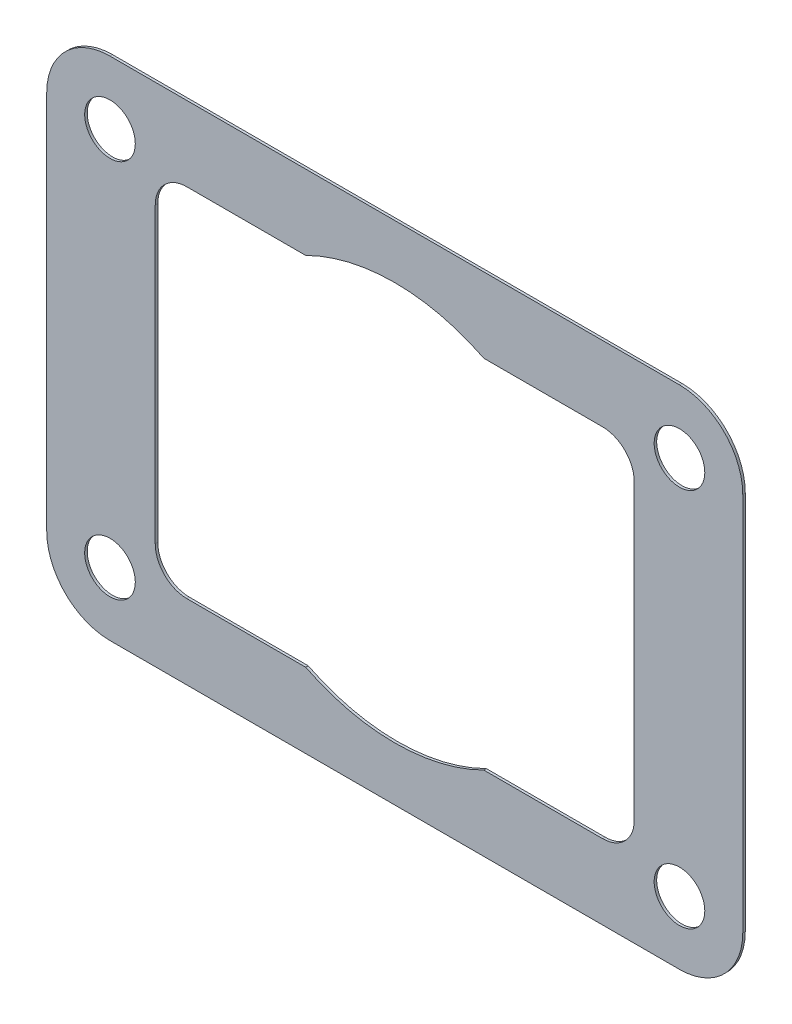
from build123d import *

# Parameters (mm, degrees)
SKETCH1_R           = 5.08
BOSS_EXTRUDE1_DEPTH = 0.508


with BuildPart() as part:
    # Sketch1 → Boss-Extrude1 (new body)
    with BuildSketch(Plane.XY):
        with BuildLine():
            Line((-57.15, -50.8), (57.15, -50.8))
            ThreePointArc((57.15, -50.8), (66.130256121, -47.080256121), (69.85, -38.1))
            Line((69.85, -38.1), (69.85, 38.1))
            ThreePointArc((69.85, 38.1), (66.130256121, 47.080256121), (57.15, 50.8))
            Line((57.15, 50.8), (-57.15, 50.8))
            ThreePointArc((-57.15, 50.8), (-66.130256121, 47.080256121), (-69.85, 38.1))
            Line((-69.85, 38.1), (-69.85, -38.1))
            ThreePointArc((-69.85, -38.1), (-66.130256121, -47.080256121), (-57.15, -50.8))
        make_face()
        with Locations((-57.15, 38.1)):
            Circle(SKETCH1_R, mode=Mode.SUBTRACT)
        with Locations((-57.15, -38.1)):
            Circle(SKETCH1_R, mode=Mode.SUBTRACT)
        with Locations((57.15, -38.1)):
            Circle(SKETCH1_R, mode=Mode.SUBTRACT)
        with Locations((57.15, 38.1)):
            Circle(SKETCH1_R, mode=Mode.SUBTRACT)
        with BuildLine():
            Line((17.876692508, 35.7886), (41.7195, 35.7886))
            ThreePointArc((41.7195, 35.7886), (46.209628061, 33.928728061), (48.0695, 29.4386))
            Line((48.0695, 29.4386), (48.0695, -29.4386))
            ThreePointArc((48.0695, -29.4386), (46.209628061, -33.928728061), (41.7195, -35.7886))
            Line((41.7195, -35.7886), (17.876692508, -35.7886))
            ThreePointArc((17.876692508, -35.7886), (0, -40.005), (-17.876692508, -35.7886))
            Line((-17.876692508, -35.7886), (-41.7195, -35.7886))
            ThreePointArc((-41.7195, -35.7886), (-46.209628061, -33.928728061), (-48.0695, -29.4386))
            Line((-48.0695, -29.4386), (-48.0695, 29.4386))
            ThreePointArc((-48.0695, 29.4386), (-46.209628061, 33.928728061), (-41.7195, 35.7886))
            Line((-41.7195, 35.7886), (-17.876692508, 35.7886))
            ThreePointArc((-17.876692508, 35.7886), (0, 40.005), (17.876692508, 35.7886))
        make_face(mode=Mode.SUBTRACT)
    extrude(amount=BOSS_EXTRUDE1_DEPTH)


solid = part.part
